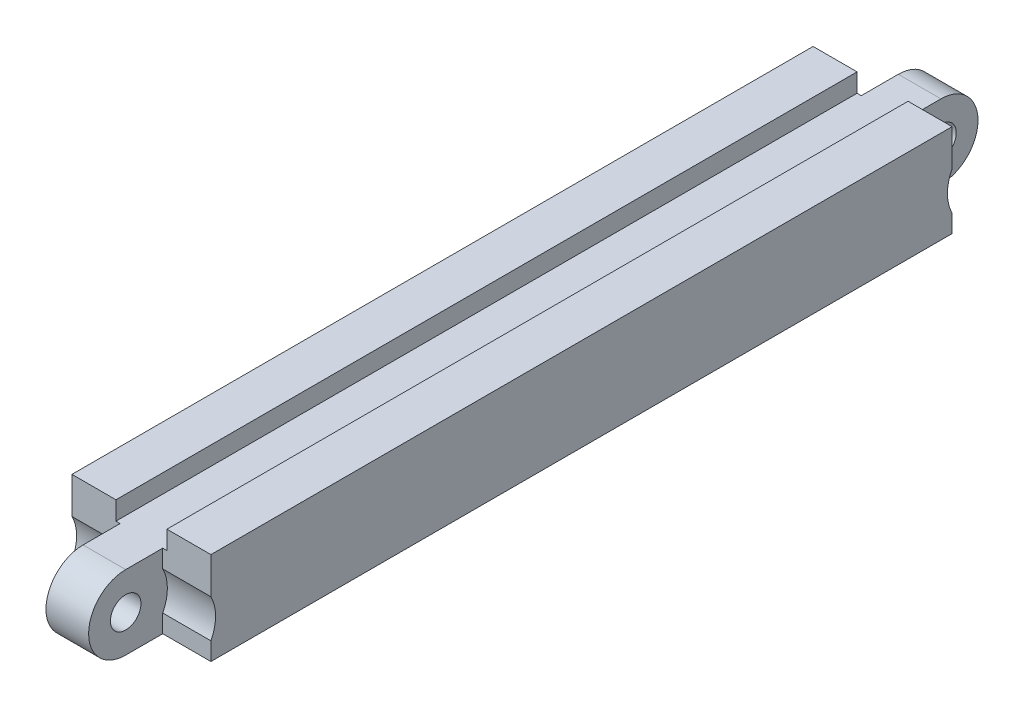
from build123d import *

# Parameters (mm, degrees)
SKETCH1_W           = 40
SKETCH1_H           = 8
SKETCH1_W_2         = 4
BOSS_EXTRUDE1_DEPTH = 7.5
BOSS_EXTRUDE2_START = 2.75
SKETCH1_5_W         = 40
SKETCH1_5_H         = 8
SKETCH1_5_H_2       = 2
SKETCH1_5_W_2       = 4
BOSS_EXTRUDE2_DEPTH = 4.75
SKETCH1_7_R         = 1.65
BOSS_EXTRUDE3_DEPTH = 2.3
CUT_EXTRUDE3_START  = 2.3
SKETCH3_R           = 4.5
CUT_EXTRUDE3_DEPTH  = 47.651506616


with BuildPart() as part:
    # Sketch1 → Boss-Extrude1 (new body)
    with BuildSketch(Plane(origin=(0, 0, 0), x_dir=(0, 0, -1), z_dir=(1, 0, 0))):
        with Locations((20, 0)):
            Rectangle(SKETCH1_W, SKETCH1_H)
        with Locations((38, 0)):
            Rectangle(SKETCH1_W_2, SKETCH1_H)
    extrude(amount=BOSS_EXTRUDE1_DEPTH)

    # Sketch1<5> → Boss-Extrude2 (add)
    with BuildSketch(Plane(origin=(0, 0, 0), x_dir=(0, 0, -1), z_dir=(1, 0, 0)).offset(BOSS_EXTRUDE2_START)):
        with Locations((20, 0)):
            Rectangle(SKETCH1_5_W, SKETCH1_5_H)
        with Locations((20, 5)):
            Rectangle(SKETCH1_5_W, SKETCH1_5_H_2)
        with Locations((38, 0)):
            Rectangle(SKETCH1_5_W_2, SKETCH1_5_H)
        with Locations((38, 5)):
            Rectangle(SKETCH1_5_W_2, SKETCH1_5_H_2)
    extrude(amount=BOSS_EXTRUDE2_DEPTH)

    # Sketch1<7> → Boss-Extrude3 (add)
    with BuildSketch(Plane(origin=(0, 0, 0), x_dir=(0, 0, -1), z_dir=(1, 0, 0))):
        with BuildLine():
            Line((44, 4), (40, 4))
            Line((40, 4), (40, -4))
            Line((40, -4), (44, -4))
            ThreePointArc((44, -4), (48, 0), (44, 4))
        make_face()
        with Locations((44, 0)):
            Circle(SKETCH1_7_R, mode=Mode.SUBTRACT)
    extrude(amount=BOSS_EXTRUDE3_DEPTH)

    # Sketch3 → Cut-Extrude3 (cut, through all)
    with BuildSketch(Plane(origin=(0, 0, 0), x_dir=(0, 0, -1), z_dir=(1, 0, 0)).offset(CUT_EXTRUDE3_START)):
        with Locations((44, 0)):
            Circle(SKETCH3_R)
    extrude(amount=CUT_EXTRUDE3_DEPTH, mode=Mode.SUBTRACT)

    # Mirror1: part across plane


with BuildPart() as part_1:
    add(part.part)
    add(part.part.mirror(Plane(origin=(0, 0, 0), x_dir=(0, 0, 1), z_dir=(1, 0, 0))))

    # Mirror2: part across plane


with BuildPart() as part_2:
    add(part_1.part)
    add(part_1.part.mirror(Plane.XY))


solid = part_2.part
